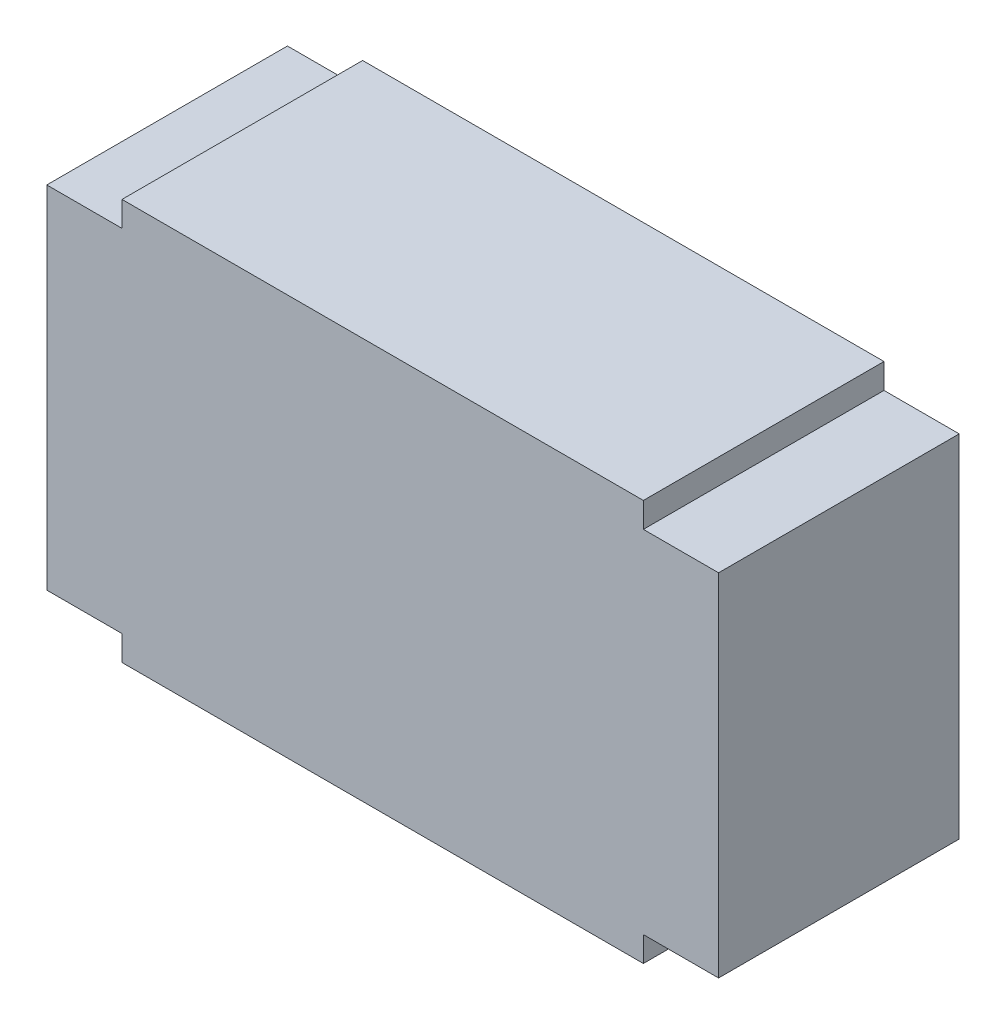
from build123d import *

# Parameters (mm, degrees)
COMPONENT_OUTLINE_DEPTH = 1.2


with BuildPart() as part:
    # 草图1 → Component_Outline (new body)
    with BuildSketch(Plane.XY):
        Polygon((-1.3, -1), (-1.3, -0.875), (-1.675, -0.875), (-1.675, 0.875), (-1.3, 0.875), (-1.3, 1), (1.3, 1), (1.3, 0.875), (1.675, 0.875), (1.675, -0.875), (1.3, -0.875), (1.3, -1), align=None)
    extrude(amount=COMPONENT_OUTLINE_DEPTH)


solid = part.part
